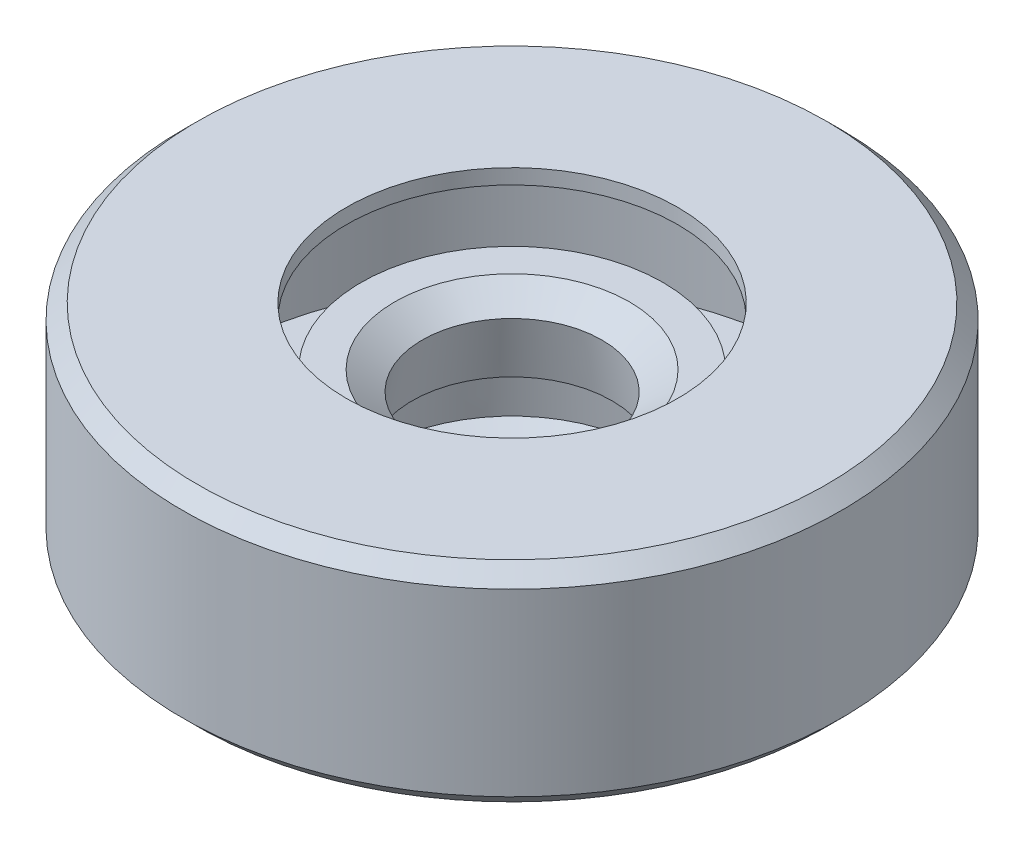
from build123d import *


with BuildPart() as part:
    # 草图1 → 旋转1 (revolve)
    with BuildSketch(Plane.XY, mode=Mode.PRIVATE) as revolve_1_sk:
        with BuildLine():
            Line((-4.838882373, 3.10342775), (-5.028769085, 0.933012702))
            Line((-5.028769085, 0.933012702), (-5.528769085, 0.933012702))
            Line((-5.528769085, 0.933012702), (-5.778769085, 0.5))
            Line((-5.778769085, 0.5), (-10, 0.5))
            Line((-10, 0.5), (-10, 6.5))
            Line((-10, 6.5), (-5.528769085, 6.5))
            Line((-5.528769085, 6.5), (-5.528769085, 7))
            Line((-5.528769085, 7), (-10.5, 7))
            Line((-10.5, 7), (-11, 6.5))
            Line((-11, 6.5), (-11, 0.5))
            Line((-11, 0.5), (-10.5, 0))
            Line((-10.5, 0), (-5.0084872, 0))
            ThreePointArc((-5.0084872, 0), (-4.6084872, 0.3), (-4.2084872, 0))
            Line((-4.2084872, 0), (-3.340059177, 0.075977607))
            Line((-3.340059177, 0.075977607), (-4.564742869, 0.5))
            Line((-4.564742869, 0.5), (-4.389765542, 2.5))
            Line((-4.389765542, 2.5), (-3.340059177, 2.5))
            Line((-3.340059177, 2.5), (-3, 4.428571429))
            Line((-3, 4.428571429), (-3.918095147, 5.071428571))
            Line((-3.918095147, 5.071428571), (-5.038882373, 5.071428571))
            Line((-5.038882373, 5.071428571), (-5.038882373, 3.950641346))
            ThreePointArc((-5.038882373, 3.950641346), (-5.274132553, 3.447892716), (-4.838882373, 3.10342775))
        make_face()
    revolve(revolve_1_sk.sketch.rotate(Axis((0, 0, 0), (0, 1, 0)), 270), axis=Axis((0, 0, 0), (0, 1, 0)))


solid = part.part
